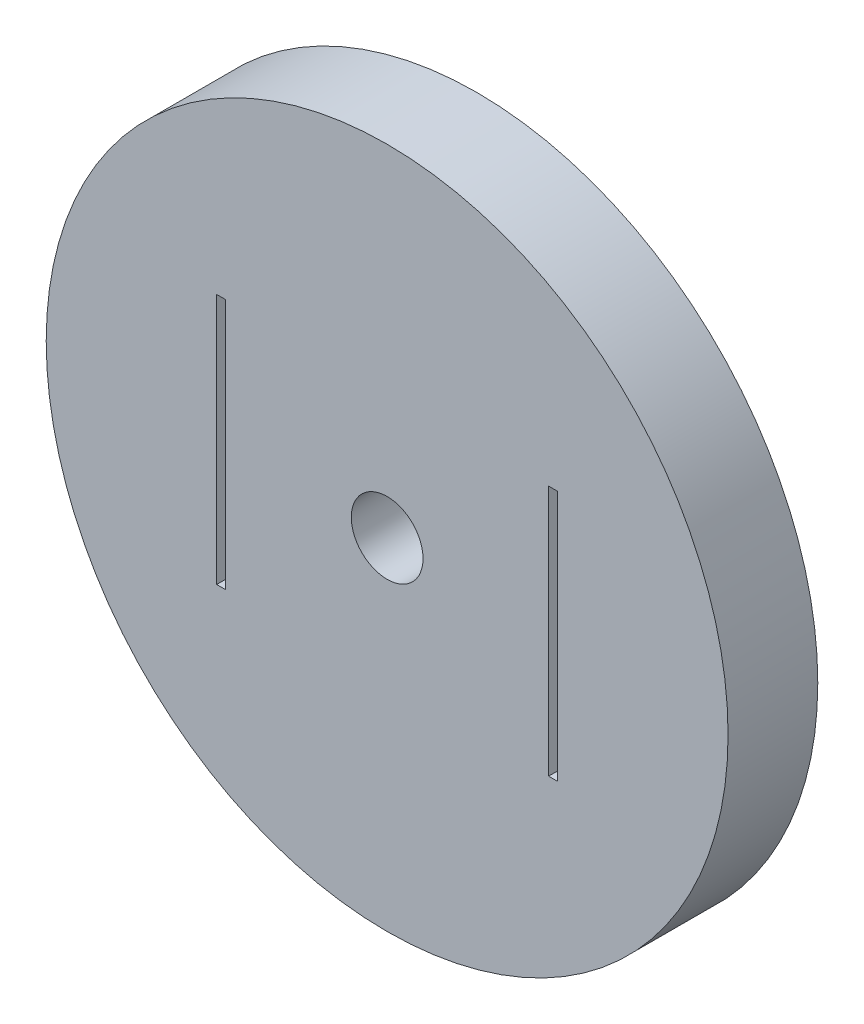
from build123d import *

# Parameters (mm, degrees)
SKETCH1_R           = 19
SKETCH1_R_2         = 2
SKETCH1_W           = 0.5
SKETCH1_H           = 14
BOSS_EXTRUDE1_DEPTH = 5


with BuildPart() as part:
    # Sketch1 → Boss-Extrude1 (new body)
    with BuildSketch(Plane.XY):
        Circle(SKETCH1_R)
        Circle(SKETCH1_R_2, mode=Mode.SUBTRACT)
        with Locations((-9.25, 0)):
            Rectangle(SKETCH1_W, SKETCH1_H, mode=Mode.SUBTRACT)
        with Locations((9.25, 0)):
            Rectangle(SKETCH1_W, SKETCH1_H, mode=Mode.SUBTRACT)
    extrude(amount=BOSS_EXTRUDE1_DEPTH)

    # Sketch3 → Revolve1 (revolve)
    with BuildSketch(Plane(origin=(0, 0, 0), x_dir=(1, 0, 0), z_dir=(0, 1, 0))):
        with BuildLine():
            Line((-17, 6), (-17, 0))
            Line((-17, 0), (-14.5, 0))
            Line((-14.5, 0), (-14.5, 8.5))
            ThreePointArc((-14.5, 8.5), (-16.267766953, 7.767766953), (-17, 6))
        make_face()
    revolve(axis=Axis((-14.5, 0, -6), (0, 0, 1)))


solid = part.part
